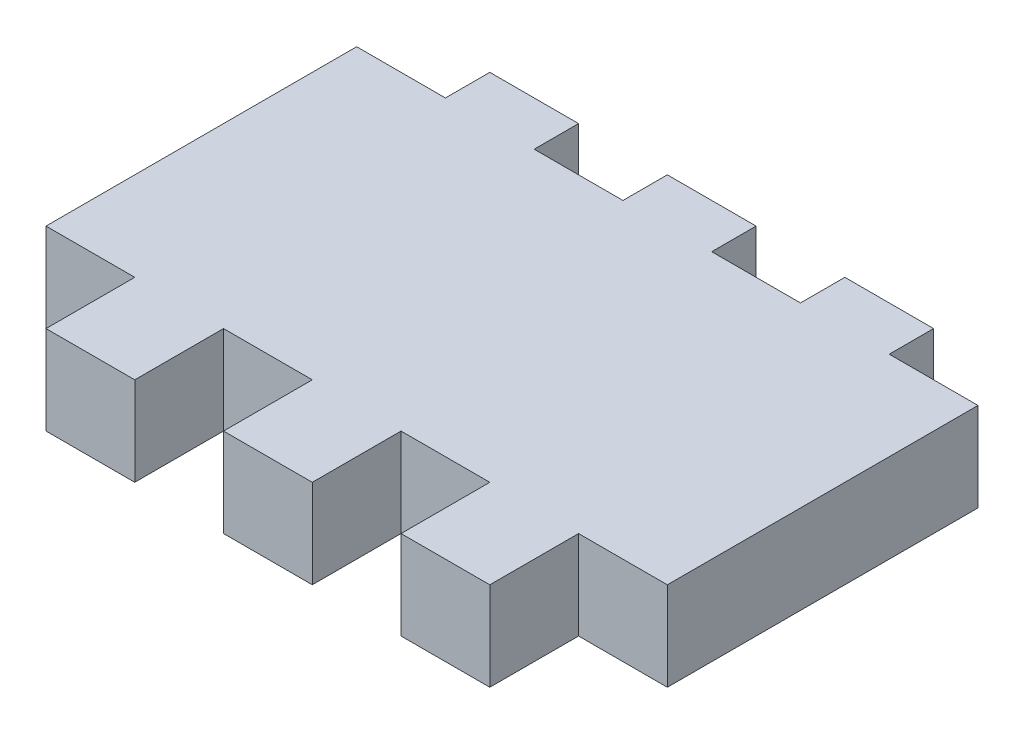
from build123d import *

# Parameters (mm, degrees)
SKETCH1_W           = 70
SKETCH1_H           = 50
BOSS_EXTRUDE1_DEPTH = 10
SKETCH2_W           = 10
SKETCH2_H           = 5
SKETCH2_H_2         = 10
CUT_EXTRUDE1_DEPTH  = 45.158804332
LPATTERN1_COUNT     = 4
LPATTERN1_PITCH     = 20


with BuildPart() as part:
    # Sketch1 → Boss-Extrude1 (new body)
    with BuildSketch(Plane(origin=(0, 0, 0), x_dir=(1, 0, 0), z_dir=(0, 1, 0))):
        Rectangle(SKETCH1_W, SKETCH1_H)
    extrude(amount=BOSS_EXTRUDE1_DEPTH)

    # Sketch2 → Cut-Extrude1 (cut, through all)
    with BuildSketch(Plane(origin=(0, 10, 0), x_dir=(1, 0, 0), z_dir=(0, 1, 0))):
        with Locations((-30, 22.5)):
            Rectangle(SKETCH2_W, SKETCH2_H)
        with Locations((-30, -20)):
            Rectangle(SKETCH2_W, SKETCH2_H_2)
    cut_extrude1 = extrude(amount=-CUT_EXTRUDE1_DEPTH, mode=Mode.SUBTRACT)

    # LPattern1: Cut-Extrude1 ×4
    with Locations(*[(i * LPATTERN1_PITCH, 0, 0) for i in range(1, LPATTERN1_COUNT)]):
        add(cut_extrude1, mode=Mode.SUBTRACT)


solid = part.part
